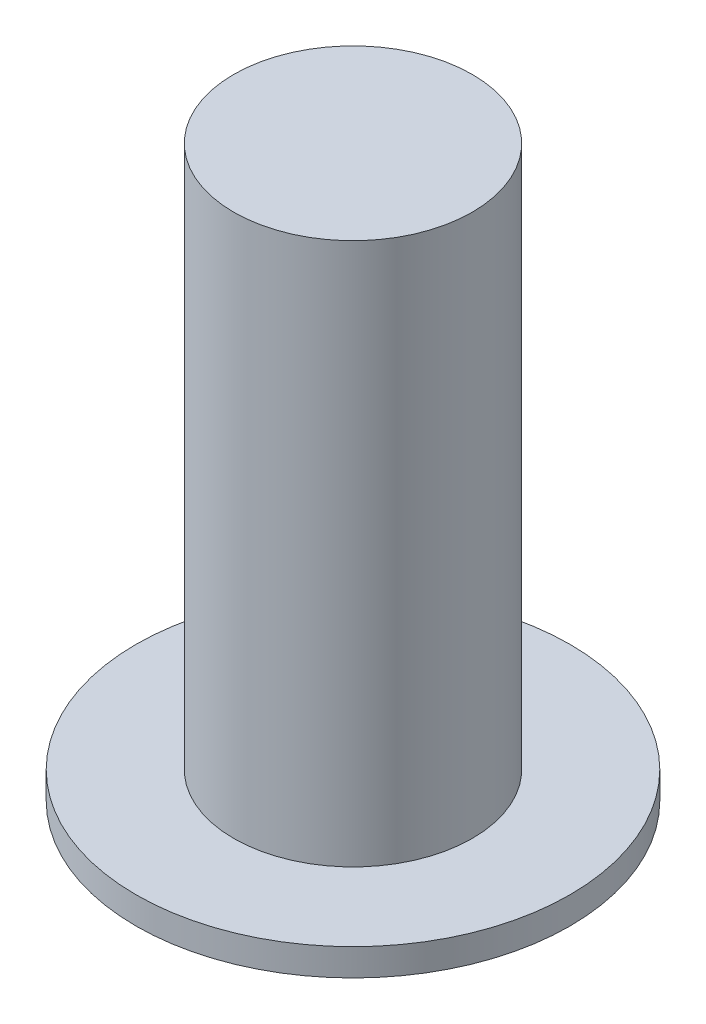
from build123d import *

# Parameters (mm, degrees)
SKETCH1_R           = 22
BOSS_EXTRUDE1_DEPTH = 100
SKETCH2_R           = 40
BOSS_EXTRUDE2_DEPTH = 5


with BuildPart() as part:
    # Sketch1 → Boss-Extrude1 (new body)
    with BuildSketch(Plane(origin=(0, 0, 0), x_dir=(1, 0, 0), z_dir=(0, 1, 0))):
        with Locations(Location((0, 0, 0), (0, 0, 270))):
            Circle(SKETCH1_R)
    extrude(amount=BOSS_EXTRUDE1_DEPTH)

    # Sketch2 → Boss-Extrude2 (add)
    with BuildSketch(Plane(origin=(0, 0, 0), x_dir=(1, 0, 0), z_dir=(0, 1, 0))):
        with Locations(Location((0, 0, 0), (0, 0, 270))):
            Circle(SKETCH2_R)
    extrude(amount=-BOSS_EXTRUDE2_DEPTH)


solid = part.part
